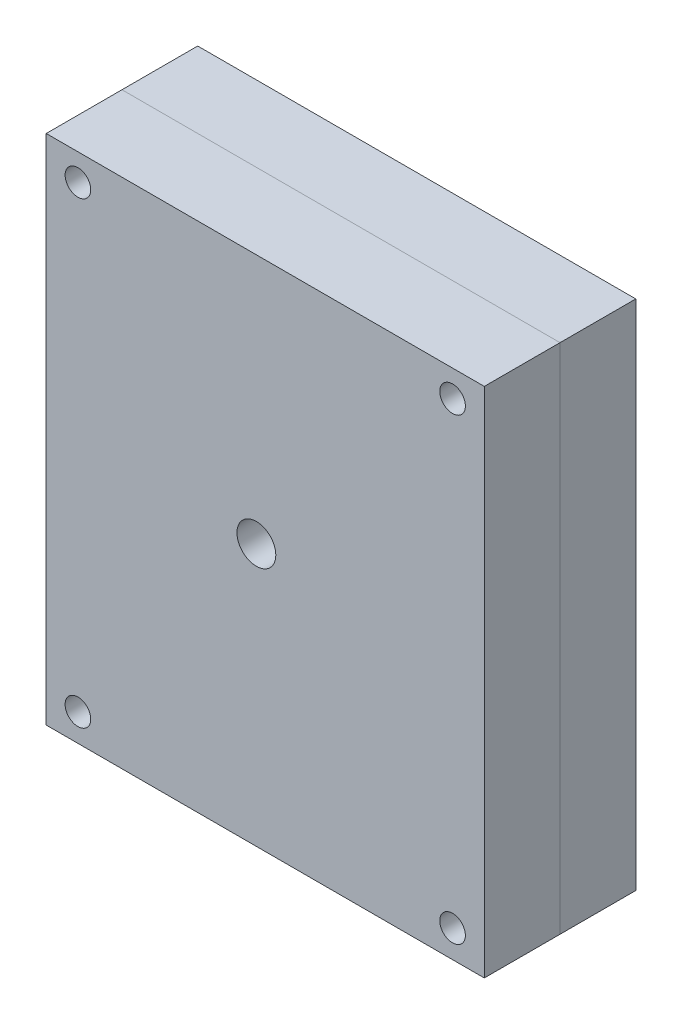
from build123d import *

# Parameters (mm, degrees)
BOSS_EXTRU_1_DEPTH      = 10
BOSS_EXTRU_3_DEPTH      = 20
BOSS_EXTRU_3_DEPTH_BACK = 20
ESQUISSE3_W             = 115.663264596
ESQUISSE3_H             = 135.276956668
ESQUISSE4_R             = 3.383953379
ENL_V_MAT_EXTRU_1_DEPTH = 30
ESQUISSE5_R             = 5.127396252
ENL_V_MAT_EXTRU_2_DEPTH = 15
ESQUISSE6_R             = 3.383953379
ENL_V_MAT_EXTRU_3_DEPTH = 15


with BuildPart() as part:
    # Esquisse1 → Boss.-Extru.1 (new body)
    with BuildSketch(Plane.XY):
        with BuildLine():
            ThreePointArc((-33.388322981, -22.272236025), (-36.923856887, -20.807769931), (-38.388322981, -17.272236025))
            Line((-38.388322981, -17.272236025), (-38.388322981, 58.227763975))
            ThreePointArc((-38.388322981, 58.227763975), (-36.923856887, 61.763297881), (-33.388322981, 63.227763975))
            Line((-33.388322981, 63.227763975), (27.529505312, 63.227763975))
            Line((27.529505312, 63.227763975), (35.611677019, 55.145592268))
            Line((35.611677019, 55.145592268), (35.611677019, -17.272236025))
            ThreePointArc((35.611677019, -17.272236025), (34.147210925, -20.807769931), (30.611677019, -22.272236025))
            Line((30.611677019, -22.272236025), (-33.388322981, -22.272236025))
        make_face()
    extrude(amount=BOSS_EXTRU_1_DEPTH)


with BuildPart() as body_2:
    # Esquisse3 → Boss.-Extru.3 (new, two sides: drawn at the far end of the back side and taken through both)
    with BuildSketch(Plane.XY.offset(5).offset(-BOSS_EXTRU_3_DEPTH_BACK)):
        with Locations((0, 23.090409061)):
            Rectangle(ESQUISSE3_W, ESQUISSE3_H)
    extrude(amount=BOSS_EXTRU_3_DEPTH + BOSS_EXTRU_3_DEPTH_BACK)

    # Combiner2: cut part
    add(part.part, mode=Mode.SUBTRACT)


with BuildPart() as body_2_2:
    # Fractionner2: the piece on the far side of the plane
    add(body_2.part)
    split(bisect_by=Plane.XY.offset(5), keep=Keep.BOTTOM)


with BuildPart() as body_2_1:
    add(body_2.part)

    # Fractionner2
    split(bisect_by=Plane.XY.offset(5), keep=Keep.TOP)


with BuildPart() as enl_v_mat_extru_1_tool:
    # Esquisse4 → Enlèv. mat.-Extru.1 (new body)
    with BuildSketch(Plane.XY.offset(25)):
        with Locations((-49.457780158, 83.721382539)):
            Circle(ESQUISSE4_R)
        with Locations((49.457780158, 83.721382539)):
            Circle(ESQUISSE4_R)
        with Locations((-49.457780158, -37.320026794)):
            Circle(ESQUISSE4_R)
        with Locations((49.457780158, -37.320026794)):
            Circle(ESQUISSE4_R)
    extrude(amount=-ENL_V_MAT_EXTRU_1_DEPTH)


with BuildPart() as body_2_3:
    add(body_2_1.part)

    # Enlèv. mat.-Extru.1: cut by enl_v_mat_extru_1_tool
    add(enl_v_mat_extru_1_tool.part, mode=Mode.SUBTRACT)

    # Esquisse5 → Enlèv. mat.-Extru.2 (cut)
    with BuildSketch(Plane.XY.offset(25)):
        with Locations((-2.342736955, 24.632350456)):
            Circle(ESQUISSE5_R)
    extrude(amount=-ENL_V_MAT_EXTRU_2_DEPTH, mode=Mode.SUBTRACT)


with BuildPart() as body_2_2_1:
    add(body_2_2.part)

    # Enlèv. mat.-Extru.1: cut by enl_v_mat_extru_1_tool
    add(enl_v_mat_extru_1_tool.part, mode=Mode.SUBTRACT)

    # Esquisse6 → Enlèv. mat.-Extru.3 (cut)
    with BuildSketch(Plane(origin=(0, 0, -15), x_dir=(-1, 0, 0), z_dir=(0, 0, -1))):
        with Locations((-33.31892558, 58.99249246)):
            Circle(ESQUISSE6_R)
        with Locations((35.921966641, 58.99249246)):
            Circle(ESQUISSE6_R)
        with Locations((-33.31892558, -20.139955792)):
            Circle(ESQUISSE6_R)
        with Locations((35.921966641, -20.139955792)):
            Circle(ESQUISSE6_R)
    extrude(amount=-ENL_V_MAT_EXTRU_3_DEPTH, mode=Mode.SUBTRACT)


solid = Compound([body_2_3.part, body_2_2_1.part])
